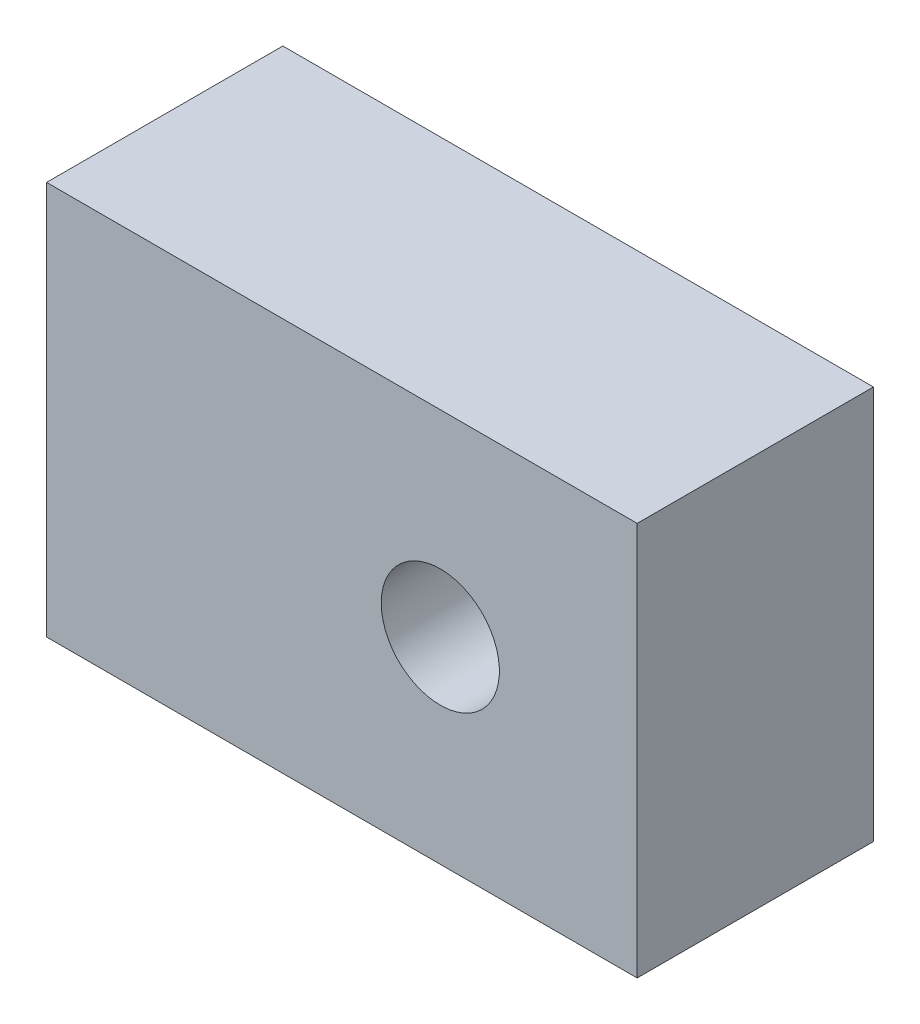
from build123d import *

# Parameters (mm, degrees)
SKETCH1_W           = 15
SKETCH1_H           = 10
BOSS_EXTRUDE1_DEPTH = 6
SKETCH2_R           = 1.5
CUT_EXTRUDE1_DEPTH  = 6


with BuildPart() as part:
    # Sketch1 → Boss-Extrude1 (new body)
    with BuildSketch(Plane.XY):
        with Locations((7.5, 5)):
            Rectangle(SKETCH1_W, SKETCH1_H)
    extrude(amount=BOSS_EXTRUDE1_DEPTH)

    # Sketch2 → Cut-Extrude1 (cut)
    with BuildSketch(Plane(origin=(0, 0, 0), x_dir=(-1, 0, 0), z_dir=(0, 0, -1))):
        with Locations((-10, 5)):
            Circle(SKETCH2_R)
    extrude(amount=-CUT_EXTRUDE1_DEPTH, mode=Mode.SUBTRACT)


solid = part.part
